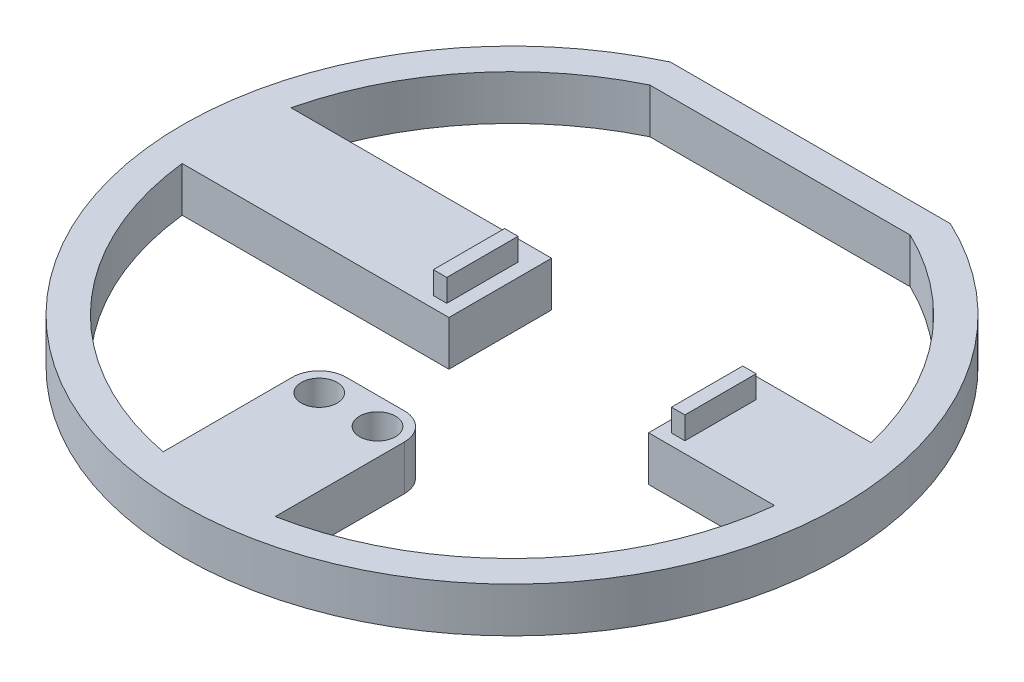
from build123d import *

# Parameters (mm, degrees)
SKETCH1_R           = 2
BOSS_EXTRUDE1_DEPTH = 5
SKETCH4_W           = 1.5
SKETCH4_H           = 7.95
BOSS_EXTRUDE2_DEPTH = 2.5


with BuildPart() as part:
    # Sketch1 → Boss-Extrude1 (new body)
    with BuildSketch(Plane(origin=(0, 0, 0), x_dir=(1, 0, 0), z_dir=(0, 1, 0))):
        with BuildLine():
            Line((-15.567316533, 33.749050158), (15.645012234, 33.749050158))
            ThreePointArc((15.645012234, 33.749050158), (0.03884785, -36.272711642), (-15.567316533, 33.749050158))
        make_face()
        with Locations(Location((-3.21115215, -17.772711642, 0), (0, 0, 270))):
            Circle(SKETCH1_R, mode=Mode.SUBTRACT)
        with Locations(Location((3.28884785, -17.772711642, 0), (0, 0, 270))):
            Circle(SKETCH1_R, mode=Mode.SUBTRACT)
        with BuildLine():
            Line((-14.493890345, 30.38317441), (14.510950609, 30.412564234))
            ThreePointArc((14.510950609, 30.412564234), (25.953877048, 21.309325265), (32.384983632, 8.177288358))
            Line((32.384983632, 8.177288358), (19.014237034, 8.177288358))
            Line((19.014237034, 8.177288358), (19.014237034, -3.272711642))
            Line((19.014237034, -3.272711642), (33.076704924, -3.272711642))
            ThreePointArc((33.076704924, -3.272711642), (24.427207658, -22.122941859), (6.28884785, -32.180023227))
            Line((6.28884785, -32.180023227), (6.28884785, -17.772711642))
            ThreePointArc((6.28884785, -17.772711642), (5.410168194, -15.651391298), (3.28884785, -14.772711642))
            Line((3.28884785, -14.772711642), (-3.21115215, -14.772711642))
            ThreePointArc((-3.21115215, -14.772711642), (-5.332472493, -15.651391298), (-6.21115215, -17.772711642))
            Line((-6.21115215, -17.772711642), (-6.21115215, -32.180023227))
            ThreePointArc((-6.21115215, -32.180023227), (-24.349511958, -22.122941859), (-32.999009223, -3.272711642))
            Line((-32.999009223, -3.272711642), (-3.25, -3.272711642))
            Line((-3.25, -3.272711642), (-3.25, 8.177288358))
            Line((-3.25, 8.177288358), (-32.307287931, 8.177288358))
            ThreePointArc((-32.307287931, 8.177288358), (-25.897276574, 21.283055583), (-14.493890345, 30.38317441))
        make_face(mode=Mode.SUBTRACT)
    extrude(amount=BOSS_EXTRUDE1_DEPTH)

    # Sketch4 → Boss-Extrude2 (add)
    with BuildSketch(Plane(origin=(0, 5, 0), x_dir=(1, 0, 0), z_dir=(0, 1, 0))):
        with Locations((21.065838417, 1.952288358)):
            Rectangle(SKETCH4_W, SKETCH4_H)
        with Locations((-5.488142716, 1.952288358)):
            Rectangle(SKETCH4_W, SKETCH4_H)
    extrude(amount=BOSS_EXTRUDE2_DEPTH)


solid = part.part
